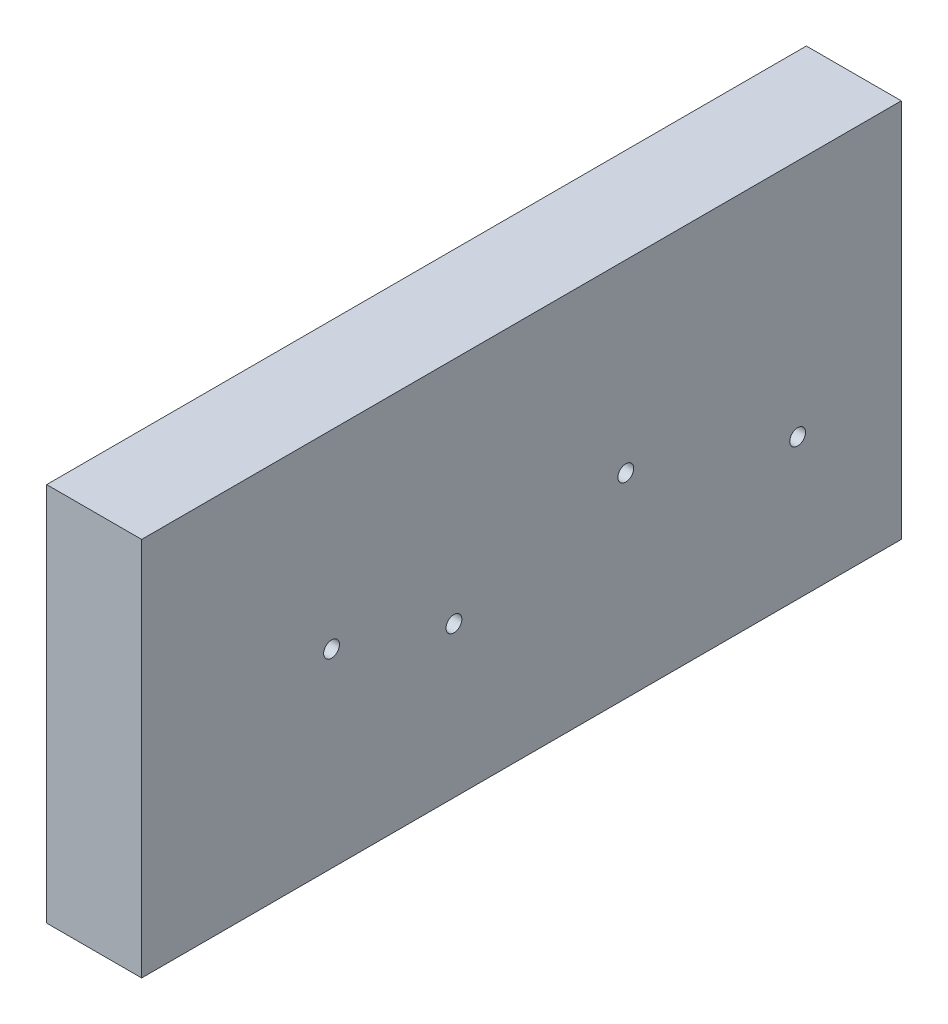
from build123d import *

# Parameters (mm, degrees)
SKETCH1_W                       = 152.4
SKETCH1_H                       = 76.2
SKETCH1_R                       = 1.5875
BOSS_EXTRUDE1_DEPTH             = 19.05
SKETCH2_R                       = 4.7625
CUT_EXTRUDE1_DEPTH              = 6.35
F_1_4_0_25_DIAMETER_HOLE1_D     = 6.35
F_1_4_0_25_DIAMETER_HOLE1_DEPTH = 12.7
F_1_4_0_25_DIAMETER_HOLE1_TIP   = 1.907732465


with BuildPart() as part:
    # Sketch1 → Boss-Extrude1 (new body)
    with BuildSketch(Plane(origin=(0, 0, 0), x_dir=(0, 0, -1), z_dir=(1, 0, 0))):
        Rectangle(SKETCH1_W, SKETCH1_H)
        with Locations((20.927, 1.096077429)):
            Circle(SKETCH1_R, mode=Mode.SUBTRACT)
        with Locations((-38.1, 0)):
            Circle(SKETCH1_R, mode=Mode.SUBTRACT)
        with Locations((55.404, -9.873506971)):
            Circle(SKETCH1_R, mode=Mode.SUBTRACT)
        with Locations((-13.55, -7.860160654)):
            Circle(SKETCH1_R, mode=Mode.SUBTRACT)
    extrude(amount=BOSS_EXTRUDE1_DEPTH)

    # Sketch2 → Cut-Extrude1 (cut)
    with BuildSketch(Plane.ZY):
        with Locations((38.1, 0)):
            Circle(SKETCH2_R)
        with Locations((13.55, -7.860160654)):
            Circle(SKETCH2_R)
        with Locations((-20.927, 1.096077429)):
            Circle(SKETCH2_R)
        with Locations((-55.404, -9.873506971)):
            Circle(SKETCH2_R)
    extrude(amount=-CUT_EXTRUDE1_DEPTH, mode=Mode.SUBTRACT)

    # 1/4 (0.25) Diameter Hole1
    with Locations(Plane.XZ.offset(38.1)):
        with Locations((9.525, -63.5), (9.525, 0), (9.525, 57.15)):
            Hole(F_1_4_0_25_DIAMETER_HOLE1_D / 2, depth=F_1_4_0_25_DIAMETER_HOLE1_DEPTH)
            with Locations((0, 0, -(F_1_4_0_25_DIAMETER_HOLE1_DEPTH + F_1_4_0_25_DIAMETER_HOLE1_TIP / 2))):  # 118° drill point
                Cone(0, F_1_4_0_25_DIAMETER_HOLE1_D / 2, F_1_4_0_25_DIAMETER_HOLE1_TIP, mode=Mode.SUBTRACT)


solid = part.part
